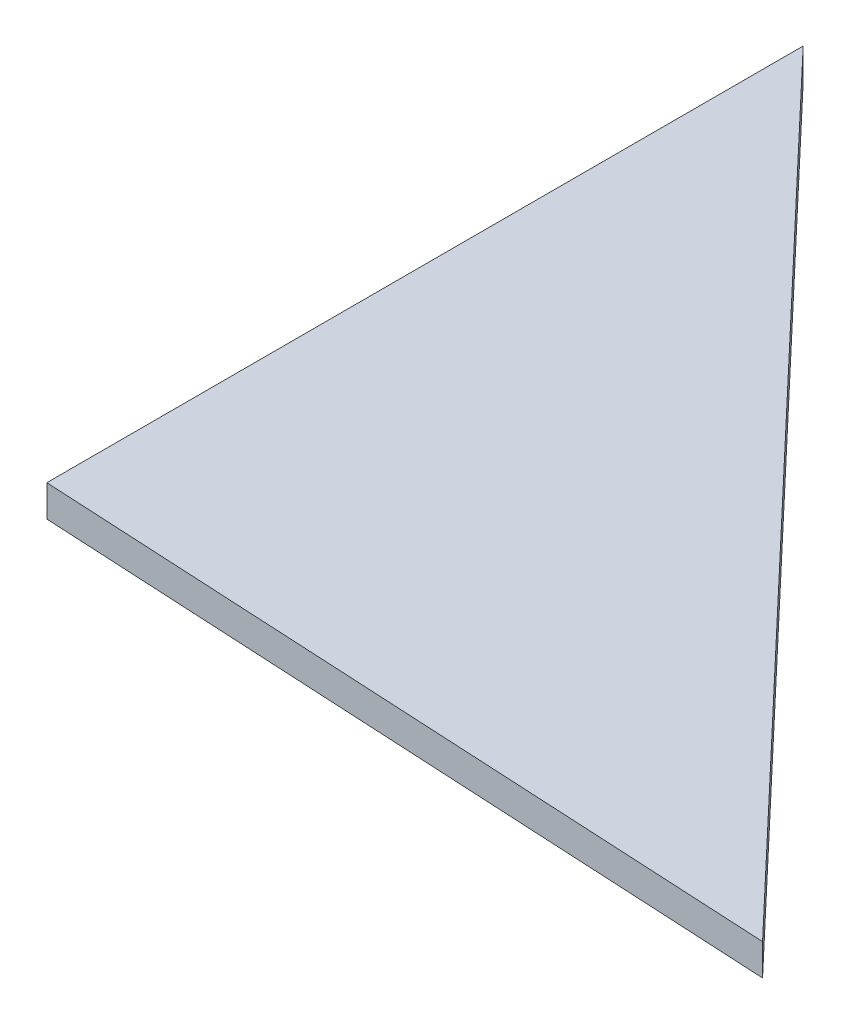
from build123d import *

# Parameters (mm, degrees)
BOSS_EXTRUDE1_DEPTH = 1.5875


with BuildPart() as part:
    # Sketch1 → Boss-Extrude1 (new body)
    with BuildSketch(Plane(origin=(0, 0, 0), x_dir=(1, 0, 0), z_dir=(0, 1, 0))):
        Polygon((-8.106514411, 33.561400995), (29.941270863, -6.532598938), (-8.106514411, -4.538599005), align=None)
    extrude(amount=BOSS_EXTRUDE1_DEPTH)


solid = part.part
